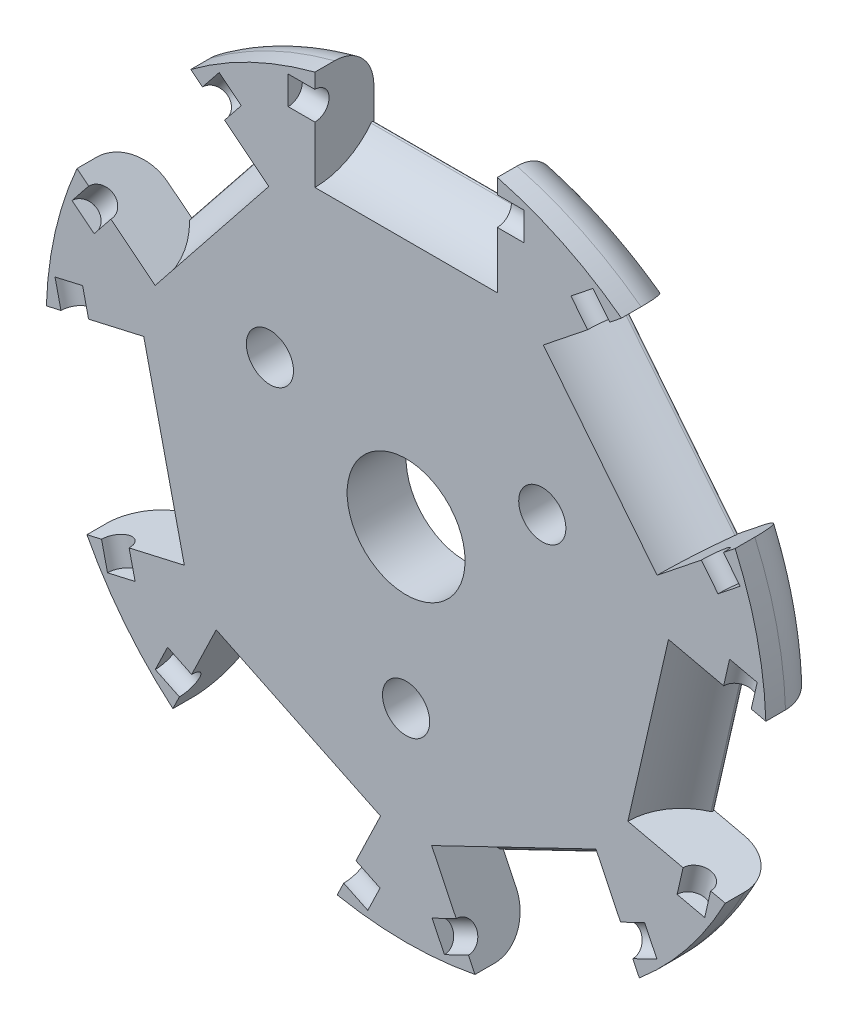
from build123d import *

# Parameters (mm, degrees)
SKETCH1_R                = 29.0703
BOSS_EXTRUDE2_DEPTH      = 4.7625
FILLET1_R                = 3.175
SKETCH2_W                = 14.732
SKETCH2_H                = 10.414
CUT_EXTRUDE2_DEPTH       = 12.7
CIRPATTERN1_COUNT        = 7
SKETCH4_R                = 1.143
CUT_EXTRUDE4_DEPTH       = 9.525
CIRPATTERN2_COUNT        = 7
SKETCH6_R                = 1.905
CUT_EXTRUDE7_DEPTH       = 42.376236281
BOSS_EXTRUDE4_REACH      = 48.843
FILLET2_R                = 0.127
CIRPATTERN5_COUNT        = 7
FILLET2_OF_CIRPATTERN5_R = 0.127
CUT_EXTRUDE9_REACH       = 43.376
SKETCH5_R                = 4.7625


with BuildPart() as part:
    # Sketch1 → Boss-Extrude2 (new body)
    with BuildSketch(Plane.XY):
        Circle(SKETCH1_R)
    extrude(amount=-BOSS_EXTRUDE2_DEPTH)

    # Fillet1
    fillet1_edges = [part.edges().sort_by_distance(p)[0] for p in [
        (-29.0703, 0, -4.7625),
    ]]
    fillet(fillet1_edges, radius=FILLET1_R)

    # Sketch2 → Cut-Extrude2 (cut)
    with BuildSketch(Plane.XY):
        with Locations((0, 25.1333)):
            Rectangle(SKETCH2_W, SKETCH2_H)
    cut_extrude2 = extrude(amount=-CUT_EXTRUDE2_DEPTH, mode=Mode.SUBTRACT)

    # CirPattern1: Cut-Extrude2 ×7 about axis
    cirpattern1_axis = Axis((0, 0, 0), (0, 0, 1))
    for i in range(1, CIRPATTERN1_COUNT):
        add(cut_extrude2.rotate(cirpattern1_axis, i * 360 / CIRPATTERN1_COUNT), mode=Mode.SUBTRACT)

    # Sketch4 → Cut-Extrude4 (cut, symmetric)
    with BuildSketch(Plane(origin=(0, 0, 0), x_dir=(0, 0, -1), z_dir=(1, 0, 0))):
        with Locations((0, 25.7683)):
            Circle(SKETCH4_R)
    cut_extrude4 = extrude(amount=CUT_EXTRUDE4_DEPTH, both=True, mode=Mode.SUBTRACT)

    # CirPattern2: Cut-Extrude4 ×7 about axis
    cirpattern2_axis = Axis((0, 0, 0), (0, 0, 1))
    for i in range(1, CIRPATTERN2_COUNT):
        add(cut_extrude4.rotate(cirpattern2_axis, i * 360 / CIRPATTERN2_COUNT), mode=Mode.SUBTRACT)

    # Sketch6 → Cut-Extrude7 (cut, through all)
    with BuildSketch(Plane(origin=(0, 0, -4.7625), x_dir=(-1, 0, 0), z_dir=(0, 0, -1))):
        with Locations((0, -12.7)):
            Circle(SKETCH6_R)
        with Locations((-10.998522628, 6.35)):
            Circle(SKETCH6_R)
        with Locations((10.998522628, 6.35)):
            Circle(SKETCH6_R)
    extrude(amount=-CUT_EXTRUDE7_DEPTH, mode=Mode.SUBTRACT)

    # Sketch10 → Boss-Extrude4 (add, up to next)
    with BuildSketch(Plane.ZY.offset(-7.366), mode=Mode.PRIVATE) as boss_extrude4_sk1:
        with BuildLine():
            Line((-4.7625, 19.9263), (0, 19.9263))
            Line((0, 19.9263), (0, 20.0533))
            ThreePointArc((0, 20.0533), (-2.7025038, 20.73265722), (-4.7625, 22.609214887))
            Line((-4.7625, 22.609214887), (-4.7625, 19.9263))
        make_face()
    boss_extrude4_tool1 = extrude(boss_extrude4_sk1.sketch, amount=BOSS_EXTRUDE4_REACH, mode=Mode.PRIVATE) - part.part
    boss_extrude4 = boss_extrude4_tool1.solids().sort_by_distance((7.366, 20.664807, -3.452063))[0]
    add(boss_extrude4)

    # Fillet2
    fillet2_edges = [part.edges().sort_by_distance(p)[0] for p in [
        (0, 22.609214887, -4.7625),
    ]]
    fillet(fillet2_edges, radius=FILLET2_R)

    # CirPattern5: Boss-Extrude4 ×7 about axis
    cirpattern5_axis = Axis((0, 0, 0), (0, 0, 1))
    for i in range(1, CIRPATTERN5_COUNT):
        add(boss_extrude4.rotate(cirpattern5_axis, i * 360 / CIRPATTERN5_COUNT))

    # Fillet2 of CirPattern5
    fillet2_of_cirpattern5_edges = [part.edges().sort_by_distance(p)[0] for p in [
        (-17.676595993, 14.09661491, -4.7625),
        (-22.042354666, -5.031023613, -4.7625),
        (-9.809770694, -20.370198741, -4.7625),
        (9.809770694, -20.370198741, -4.7625),
        (22.042354666, -5.031023613, -4.7625),
        (17.676595993, 14.09661491, -4.7625),
    ]]
    fillet(fillet2_of_cirpattern5_edges, radius=FILLET2_OF_CIRPATTERN5_R)

    # Sketch5 → Cut-Extrude9 (cut, up to next)
    with BuildSketch(Plane.XY, mode=Mode.PRIVATE) as cut_extrude9_sk1:
        Circle(SKETCH5_R)
    cut_extrude9_tool1 = extrude(cut_extrude9_sk1.sketch, amount=-CUT_EXTRUDE9_REACH, mode=Mode.PRIVATE) & part.part
    add(cut_extrude9_tool1.solids().sort_by_distance((0, 0, 0))[0], mode=Mode.SUBTRACT)


solid = part.part
